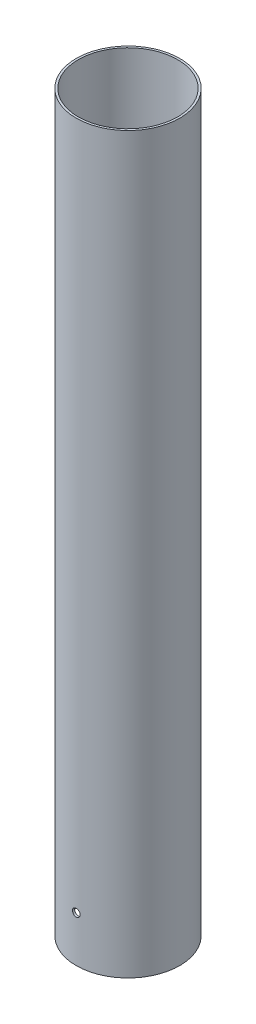
from build123d import *

# Parameters (mm, degrees)
SKETCH1_R               = 43
SKETCH1_R_2             = 41.25
BOSS_EXTRUDE1_DEPTH     = 609.6
CUT_EXTRUDE1_DEPTH      = 613.625627933
CUT_EXTRUDE1_DEPTH_BACK = 613.625627933
SKETCH2_R               = 3.175


with BuildPart() as part:
    # Sketch1 → Boss-Extrude1 (new body)
    with BuildSketch(Plane(origin=(0, 0, 0), x_dir=(1, 0, 0), z_dir=(0, 1, 0))):
        with Locations(Location((0, 0, 0), (0, 0, 90))):
            Circle(SKETCH1_R)
        with Locations(Location((0, 0, 0), (0, 0, 90))):
            Circle(SKETCH1_R_2, mode=Mode.SUBTRACT)
    extrude(amount=BOSS_EXTRUDE1_DEPTH)

    # Sketch2 → Cut-Extrude1 (cut, two sides: drawn at the far end of the back side and taken through both)
    with BuildSketch(Plane.XY.offset(-CUT_EXTRUDE1_DEPTH_BACK)):
        with Locations((0, 38.1)):
            Circle(SKETCH2_R)
    extrude(amount=CUT_EXTRUDE1_DEPTH + CUT_EXTRUDE1_DEPTH_BACK, mode=Mode.SUBTRACT)


solid = part.part
